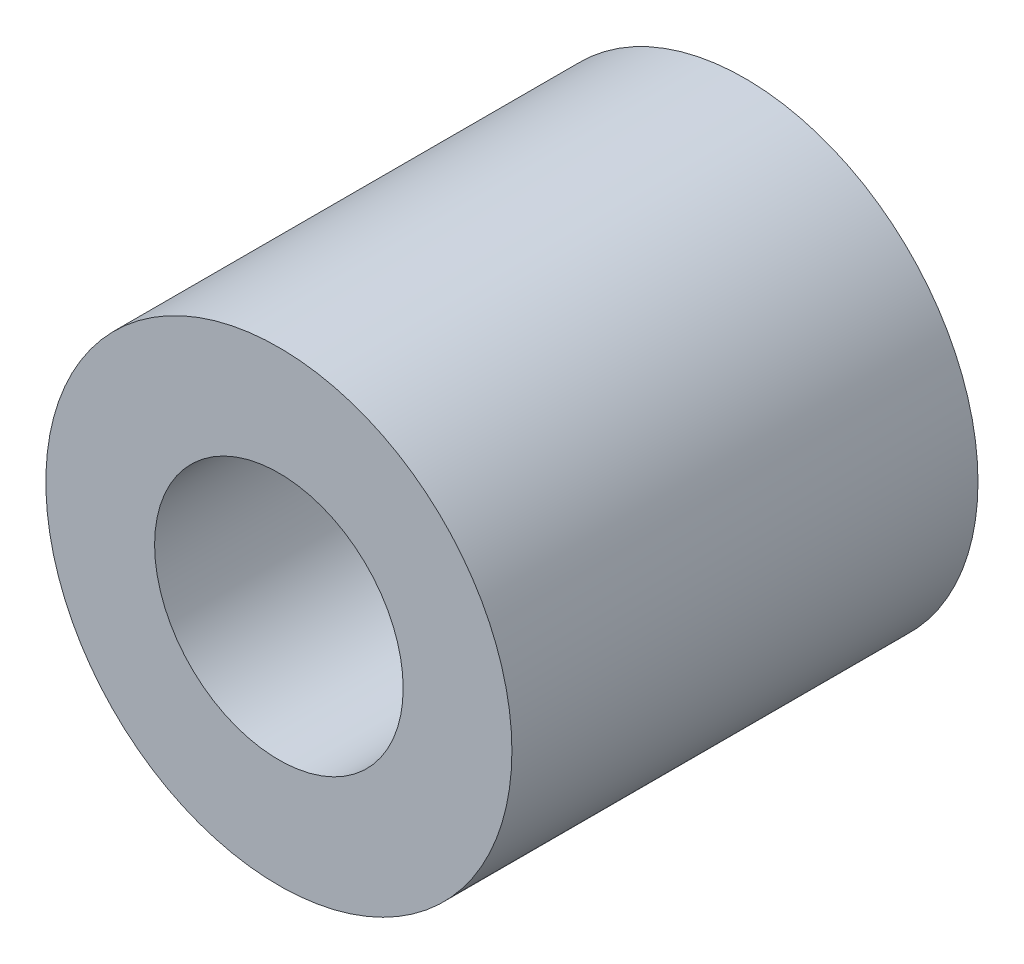
from build123d import *

# Parameters (mm, degrees)
SKETCH_1_R      = 3
SKETCH_1_R_2    = 1.6
EXTRUDE_1_DEPTH = 3


with BuildPart() as part:
    # ｽｹｯﾁ1 → ﾎﾞｽ - 押し出し1 (new, symmetric)
    with BuildSketch(Plane.XY):
        Circle(SKETCH_1_R)
        Circle(SKETCH_1_R_2, mode=Mode.SUBTRACT)
    extrude(amount=EXTRUDE_1_DEPTH, both=True)


solid = part.part
